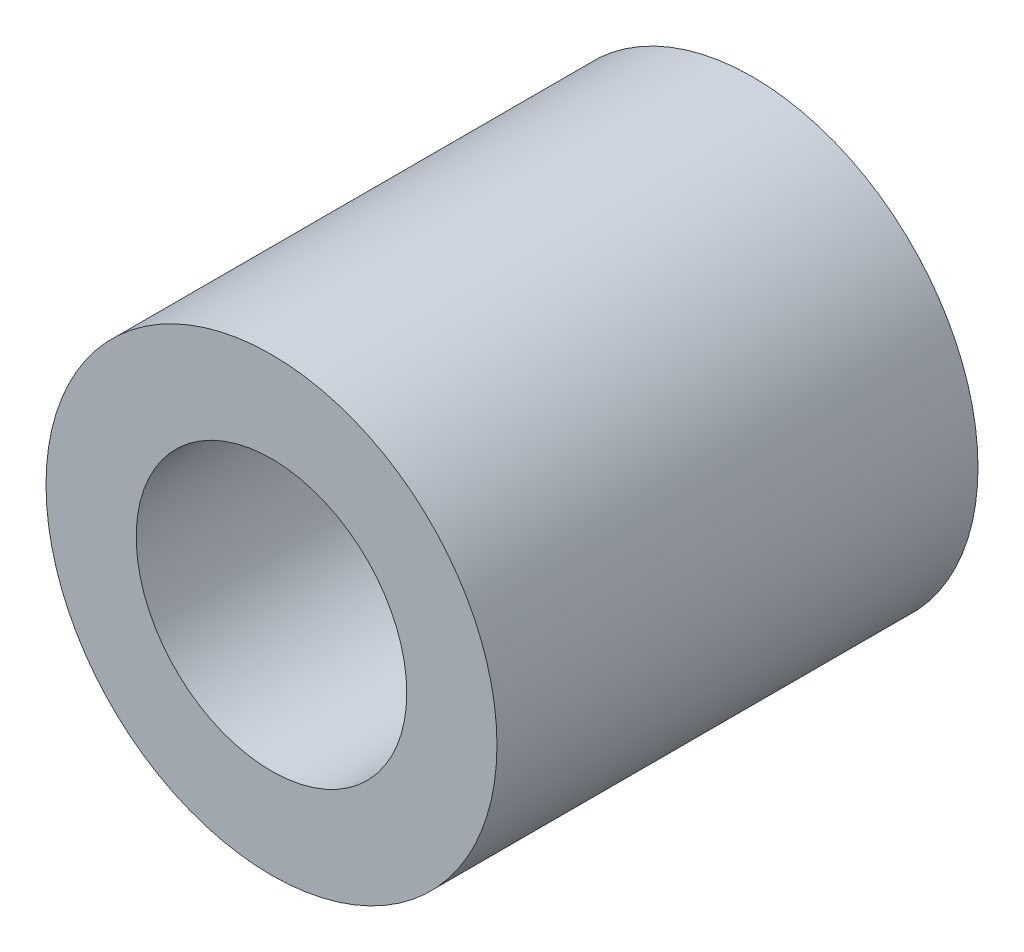
from build123d import *

# Parameters (mm, degrees)
SKETCH_1_R      = 7.5
SKETCH_1_R_2    = 4.5
EXTRUDE_1_DEPTH = 8


with BuildPart() as part:
    # 草图1 → 凸台-拉伸1 (new, symmetric)
    with BuildSketch(Plane.XY):
        Circle(SKETCH_1_R)
        Circle(SKETCH_1_R_2, mode=Mode.SUBTRACT)
    extrude(amount=EXTRUDE_1_DEPTH, both=True)


solid = part.part
